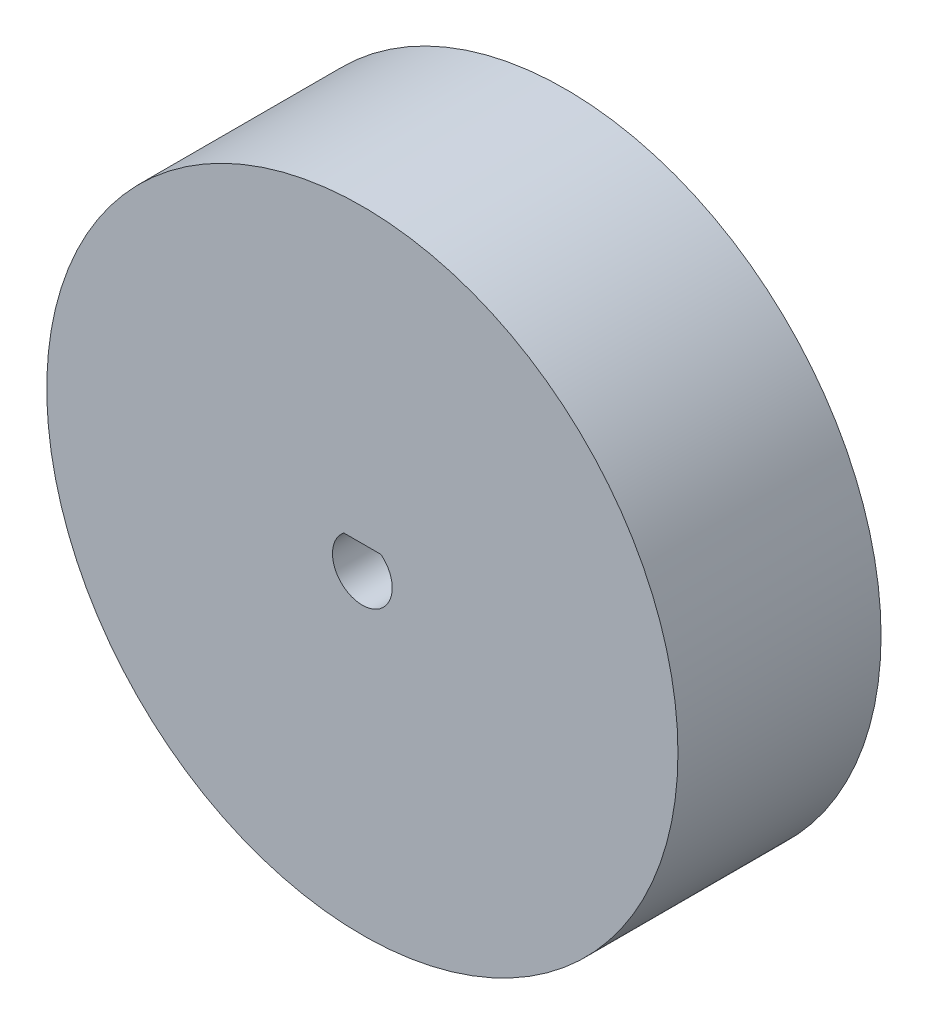
from build123d import *

# Parameters (mm, degrees)
SKETCH1_R           = 21.59999998
BOSS_EXTRUDE1_DEPTH = 13.899999886


with BuildPart() as part:
    # Sketch1 → Boss-Extrude1 (new body)
    with BuildSketch(Plane.XY):
        Circle(SKETCH1_R)
        with BuildLine():
            Line((-1.27, 1.602466252), (1.27, 1.602466252))
            ThreePointArc((1.27, 1.602466252), (0, -2.0447), (-1.27, 1.602466252))
        make_face(mode=Mode.SUBTRACT)
    extrude(amount=BOSS_EXTRUDE1_DEPTH)


solid = part.part
